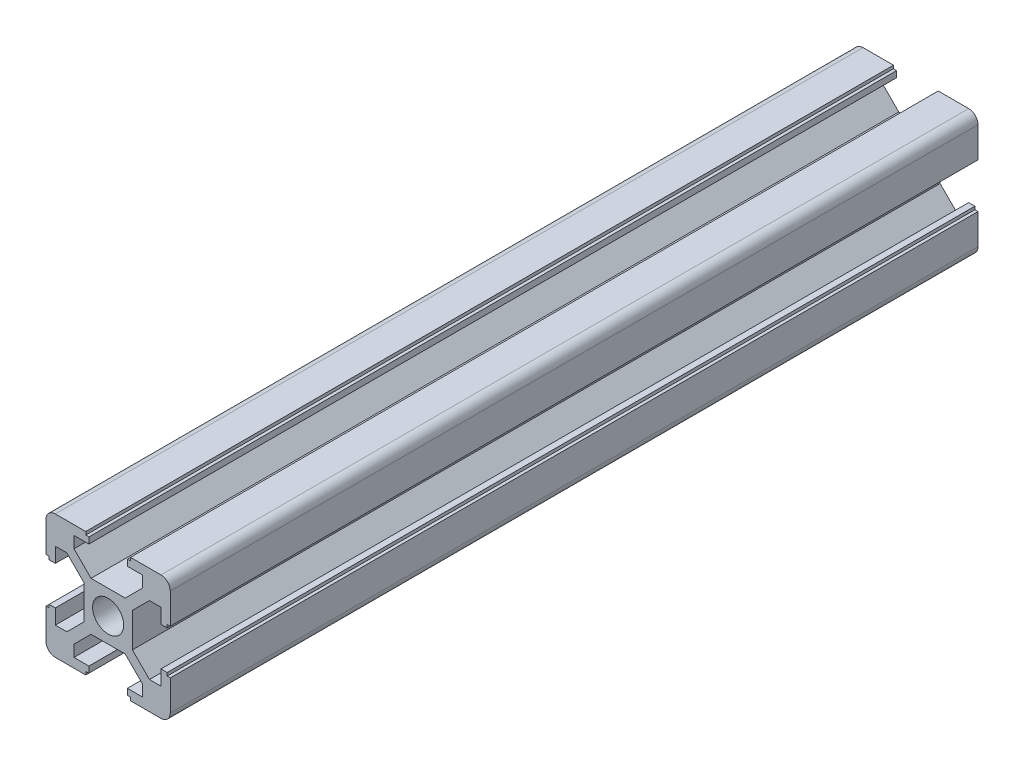
from build123d import *

# Parameters (mm, degrees)
SKETCH_2_R      = 2.5
EXTRUDE_1_DEPTH = 130


with BuildPart() as part:
    # 草图2 → 凸台-拉伸1 (new body)
    with BuildSketch(Plane.XY):
        with BuildLine():
            Line((-3.6, 10), (-3.6, 9.5))
            Line((-3.6, 9.5), (-3.1, 9.5))
            Line((-3.1, 9.5), (-3.1, 8.5))
            Line((-3.1, 8.5), (-5.5, 8.5))
            Line((-5.5, 8.5), (-5.5, 6.65))
            Line((-5.5, 6.65), (-2.75, 3.9))
            Line((-2.75, 3.9), (2.75, 3.9))
            Line((2.75, 3.9), (5.5, 6.65))
            Line((5.5, 6.65), (5.5, 8.5))
            Line((5.5, 8.5), (3.1, 8.5))
            Line((3.1, 8.5), (3.1, 9.5))
            Line((3.1, 9.5), (3.6, 9.5))
            Line((3.6, 9.5), (3.6, 10))
            Line((3.6, 10), (8.5, 10))
            ThreePointArc((8.5, 10), (9.560660172, 9.560660172), (10, 8.5))
            Line((10, 8.5), (10, 3.6))
            Line((10, 3.6), (9.5, 3.6))
            Line((9.5, 3.6), (9.5, 3.1))
            Line((9.5, 3.1), (8.5, 3.1))
            Line((8.5, 3.1), (8.5, 5.5))
            Line((8.5, 5.5), (6.65, 5.5))
            Line((6.65, 5.5), (3.9, 2.75))
            Line((3.9, 2.75), (3.9, -2.75))
            Line((3.9, -2.75), (6.65, -5.5))
            Line((6.65, -5.5), (8.5, -5.5))
            Line((8.5, -5.5), (8.5, -3.1))
            Line((8.5, -3.1), (9.5, -3.1))
            Line((9.5, -3.1), (9.5, -3.6))
            Line((9.5, -3.6), (10, -3.6))
            Line((10, -3.6), (10, -8.5))
            ThreePointArc((10, -8.5), (9.560660172, -9.560660172), (8.5, -10))
            Line((8.5, -10), (3.6, -10))
            Line((3.6, -10), (3.6, -9.5))
            Line((3.6, -9.5), (3.1, -9.5))
            Line((3.1, -9.5), (3.1, -8.5))
            Line((3.1, -8.5), (5.5, -8.5))
            Line((5.5, -8.5), (5.5, -6.65))
            Line((5.5, -6.65), (2.75, -3.9))
            Line((2.75, -3.9), (-2.75, -3.9))
            Line((-2.75, -3.9), (-5.5, -6.65))
            Line((-5.5, -6.65), (-5.5, -8.5))
            Line((-5.5, -8.5), (-3.1, -8.5))
            Line((-3.1, -8.5), (-3.1, -9.5))
            Line((-3.1, -9.5), (-3.6, -9.5))
            Line((-3.6, -9.5), (-3.6, -10))
            Line((-3.6, -10), (-8.5, -10))
            ThreePointArc((-8.5, -10), (-9.560660172, -9.560660172), (-10, -8.5))
            Line((-10, -8.5), (-10, -3.6))
            Line((-10, -3.6), (-9.5, -3.6))
            Line((-9.5, -3.6), (-9.5, -3.1))
            Line((-9.5, -3.1), (-8.5, -3.1))
            Line((-8.5, -3.1), (-8.5, -5.5))
            Line((-8.5, -5.5), (-6.65, -5.5))
            Line((-6.65, -5.5), (-3.9, -2.75))
            Line((-3.9, -2.75), (-3.9, 2.75))
            Line((-3.9, 2.75), (-6.65, 5.5))
            Line((-6.65, 5.5), (-8.5, 5.5))
            Line((-8.5, 5.5), (-8.5, 3.1))
            Line((-8.5, 3.1), (-9.5, 3.1))
            Line((-9.5, 3.1), (-9.5, 3.6))
            Line((-9.5, 3.6), (-10, 3.6))
            Line((-10, 3.6), (-10, 8.5))
            ThreePointArc((-10, 8.5), (-9.560660172, 9.560660172), (-8.5, 10))
            Line((-8.5, 10), (-3.6, 10))
        make_face()
        Circle(SKETCH_2_R, mode=Mode.SUBTRACT)
    extrude(amount=EXTRUDE_1_DEPTH)


solid = part.part
